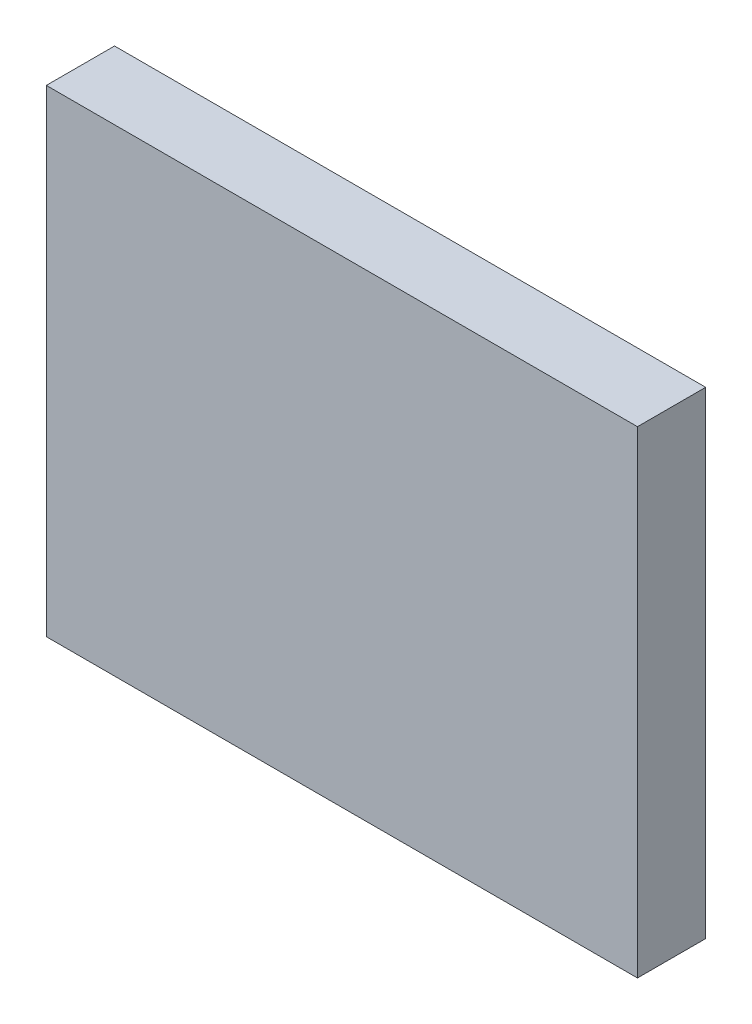
from build123d import *

# Parameters (mm, degrees)
SKETCH_1_W      = 26
SKETCH_1_H      = 21
EXTRUDE_1_DEPTH = 3


with BuildPart() as part:
    # Эскиз1 → Бобышка-Вытянуть1 (new body)
    with BuildSketch(Plane.XY):
        Rectangle(SKETCH_1_W, SKETCH_1_H)
    extrude(amount=EXTRUDE_1_DEPTH)


solid = part.part
